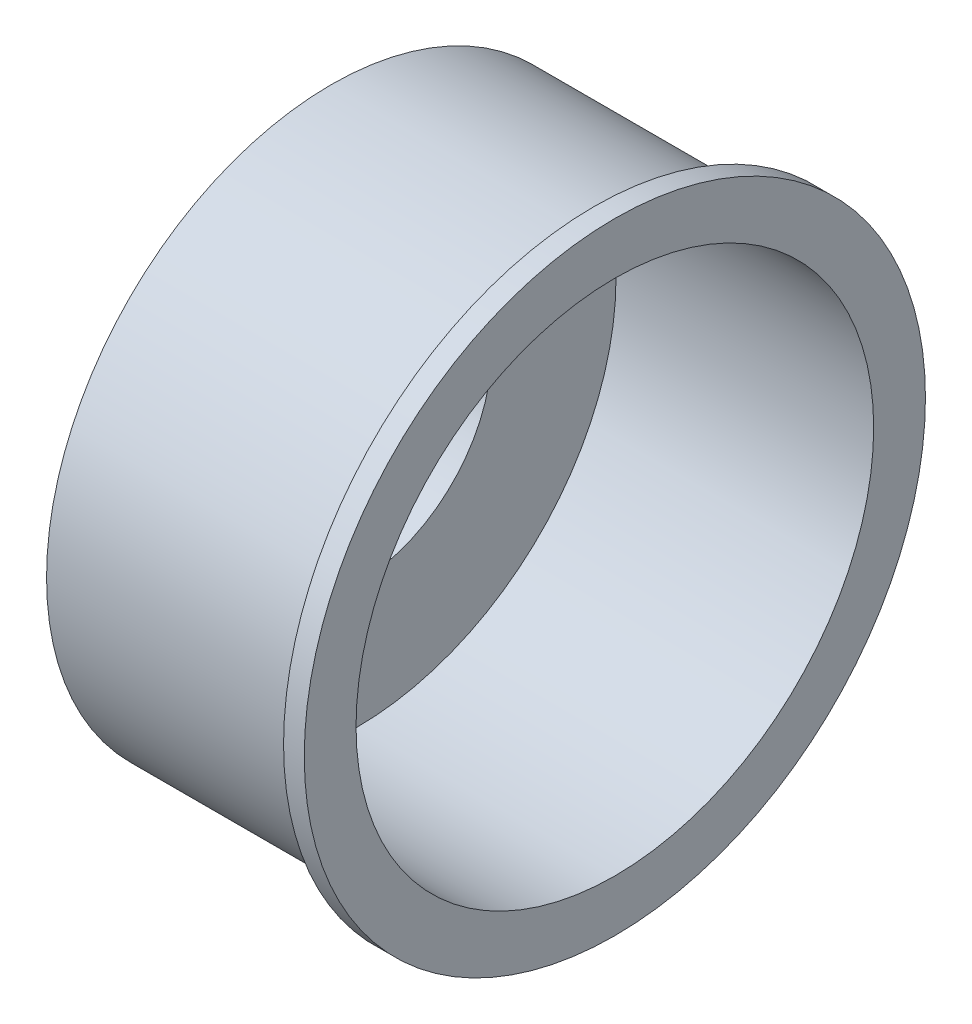
from build123d import *


with BuildPart() as part:
    # Sketch2 → Revolve2 (revolve)
    with BuildSketch(Plane.XY, mode=Mode.PRIVATE) as revolve2_sk:
        Polygon((54.784331473, 60), (50.784331473, 60), (50.784331473, 55), (0, 55), (0, 26), (5, 26), (5, 50), (54.784331473, 50), align=None)
    revolve(revolve2_sk.sketch.rotate(Axis((-500, 0, 0), (1, 0, 0)), 90), axis=Axis((-500, 0, 0), (1, 0, 0)))


solid = part.part
